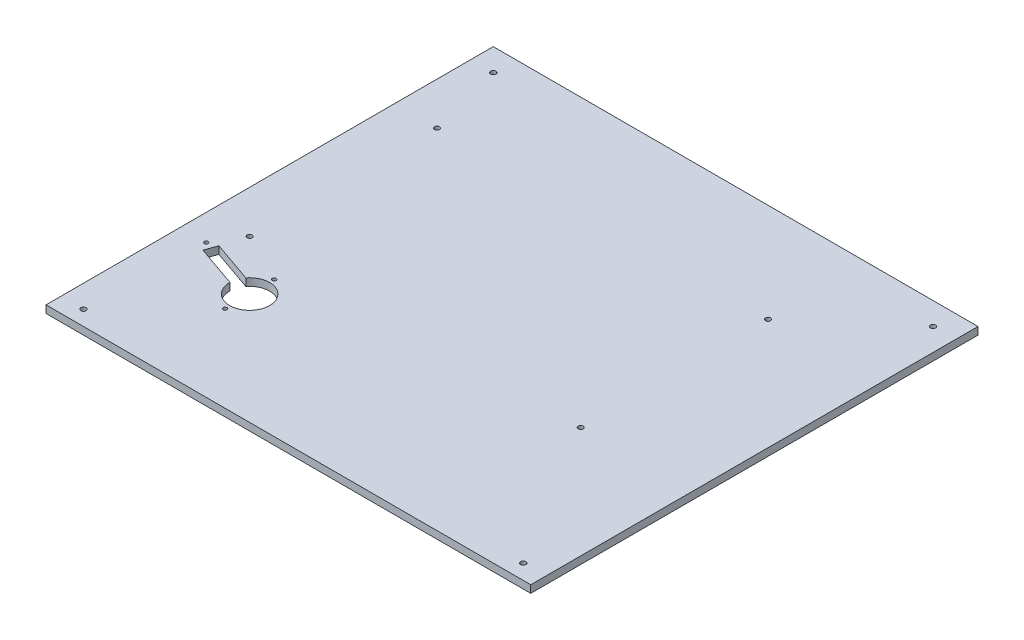
from build123d import *

# Parameters (mm, degrees)
SKETCH1_W           = 390
SKETCH1_H           = 360
SKETCH1_R           = 2.1
SKETCH1_R_2         = 16
SKETCH1_R_3         = 2
SKETCH1_R_4         = 1.55
BOSS_EXTRUDE1_DEPTH = 6
CUT_EXTRUDE1_REACH  = 267.445
SKETCH5_W           = 390
SKETCH5_H           = 1
CUT_EXTRUDE2_DEPTH  = 266.444909539
CUT_EXTRUDE3_DEPTH  = 266.444909539


with BuildPart() as part:
    # Sketch1 → Boss-Extrude1 (new body)
    with BuildSketch(Plane(origin=(0, 0, 0), x_dir=(1, 0, 0), z_dir=(0, 1, 0))):
        Rectangle(SKETCH1_W, SKETCH1_H)
        with Locations(Location((-176, 161, 0), (0, 0, 270))):
            Circle(SKETCH1_R, mode=Mode.SUBTRACT)
        with Locations(Location((-176, -167, 0), (0, 0, 270))):
            Circle(SKETCH1_R, mode=Mode.SUBTRACT)
        with Locations(Location((-120, -90, 0), (0, 0, 270))):
            Circle(SKETCH1_R_2, mode=Mode.SUBTRACT)
        with Locations(Location((176, -167, 0), (0, 0, 90))):
            Circle(SKETCH1_R, mode=Mode.SUBTRACT)
        with Locations(Location((176, 161, 0), (0, 0, 90))):
            Circle(SKETCH1_R, mode=Mode.SUBTRACT)
        with Locations(Location((-160, -50, 0), (0, 0, 270))):
            Circle(SKETCH1_R_3, mode=Mode.SUBTRACT)
        with Locations(Location((-160, 100, 0), (0, 0, 270))):
            Circle(SKETCH1_R_3, mode=Mode.SUBTRACT)
        with Locations(Location((105, -50, 0), (0, 0, 270))):
            Circle(SKETCH1_R_3, mode=Mode.SUBTRACT)
        with Locations(Location((105, 100, 0), (0, 0, 270))):
            Circle(SKETCH1_R_3, mode=Mode.SUBTRACT)
        with Locations(Location((-119.684190721, -109.997506457, 0), (0, 0, 270))):
            Circle(SKETCH1_R_4, mode=Mode.SUBTRACT)
        with Locations(Location((-120.315809279, -70.002493543, 0), (0, 0, 270))):
            Circle(SKETCH1_R_4, mode=Mode.SUBTRACT)
        with Locations(Location((-173.106414611, -71.615200698, 0), (0, 0, 270))):
            Circle(SKETCH1_R_4, mode=Mode.SUBTRACT)
    extrude(amount=BOSS_EXTRUDE1_DEPTH)

    # Sketch4 → Cut-Extrude1 (cut, up to next)
    with BuildSketch(Plane(origin=(0, 6, 0), x_dir=(1, 0, 0), z_dir=(0, 1, 0)), mode=Mode.PRIVATE) as cut_extrude1_sk1:
        with BuildLine():
            Line((-135.998409614, -89.77441229), (-169.072254333, -78.302916757))
            Line((-169.072254333, -78.302916757), (-165.800861457, -68.853156465))
            Line((-165.800861457, -68.853156465), (-132.726704425, -80.303041999))
            ThreePointArc((-132.726704425, -80.303041999), (-104.876846958, -95.224006323), (-135.998409614, -89.77441229))
        make_face()
    cut_extrude1_tool1 = extrude(cut_extrude1_sk1.sketch, amount=-CUT_EXTRUDE1_REACH, mode=Mode.PRIVATE) & part.part
    add(cut_extrude1_tool1.solids().sort_by_distance((-129.350351, 6, 86.764679))[0], mode=Mode.SUBTRACT)

    # Sketch5 → Cut-Extrude2 (cut, through all)
    with BuildSketch(Plane(origin=(0, 6, 0), x_dir=(1, 0, 0), z_dir=(0, 1, 0))):
        with Locations((0, -179.5)):
            Rectangle(SKETCH5_W, SKETCH5_H)
    extrude(amount=-CUT_EXTRUDE2_DEPTH, mode=Mode.SUBTRACT)

    # Sketch6 → Cut-Extrude3 (cut, through all)
    with BuildSketch(Plane(origin=(0, 6, 0), x_dir=(1, 0, 0), z_dir=(0, 1, 0))):
        Polygon((195, -179), (195, 180), (-195, 180), (-195, -179), (-194, -179), (-194, 179), (194, 179), (194, -179), align=None)
    extrude(amount=-CUT_EXTRUDE3_DEPTH, mode=Mode.SUBTRACT)


solid = part.part
